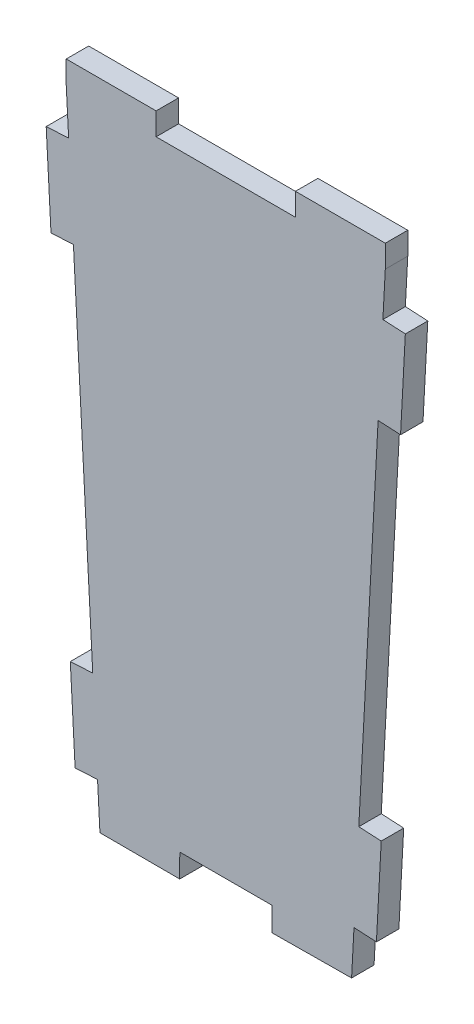
from build123d import *

# Parameters (mm, degrees)
BOSS_EXTRUDE1_DEPTH = 2.5


with BuildPart() as part:
    # Sketch2 → Boss-Extrude1 (new, symmetric)
    with BuildSketch(Plane.XY):
        Polygon((681.706291729, -153.636731681), (682.239870804, -143.650977159), (687.232748065, -143.917766696), (688.299906214, -123.946257652), (683.307028953, -123.679468115), (687.605554505, -43.233995246), (692.598431766, -43.500784784), (693.665589915, -23.52927574), (688.672712654, -23.262486203), (689.206291729, -13.276731681), (689.206291729, -8.276731681), (669.206291729, -8.276731681), (669.206291729, -13.276731681), (638.206322644, -13.276731681), (638.206322644, -8.276731681), (618.206322644, -8.276731681), (618.206322644, -13.276731681), (618.739901719, -23.262486203), (613.747024458, -23.52927574), (614.814182607, -43.500784784), (619.807059868, -43.233995246), (624.10558542, -123.679468115), (619.11270816, -123.946257652), (620.179866309, -143.917766696), (625.17274357, -143.650977159), (625.706860825, -153.646803556), (643.457267186, -153.686006411), (643.468758324, -148.483008314), (663.968757652, -148.476325927), (663.968757652, -153.784407031), align=None)
    extrude(amount=BOSS_EXTRUDE1_DEPTH, both=True)


solid = part.part
